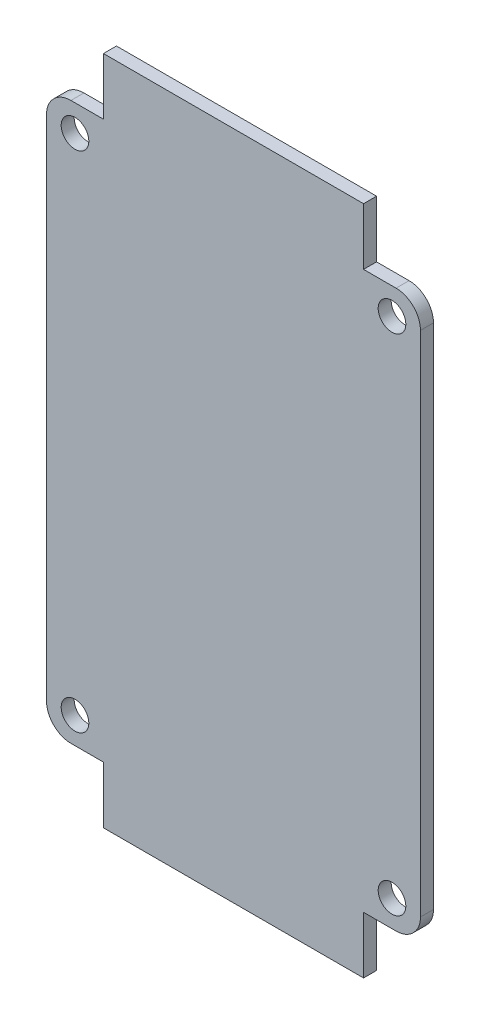
from build123d import *

# Parameters (mm, degrees)
EXTRUDE_1_DEPTH       = 1.6
HOLE_WIZARD_M31_D     = 3.4
HOLE_WIZARD_M31_DEPTH = 10
HOLE_WIZARD_M31_TIP   = 1.021463052


with BuildPart() as part:
    # Эскиз1 → Бобышка-Вытянуть1 (new body)
    with BuildSketch(Plane.XY):
        with BuildLine():
            Line((-16, 34.25), (-16, 41.25))
            Line((-16, 41.25), (16, 41.25))
            Line((16, 41.25), (16, 34.25))
            Line((16, 34.25), (20, 34.25))
            ThreePointArc((20, 34.25), (22.121320344, 33.371320344), (23, 31.25))
            Line((23, 31.25), (23, -31.25))
            ThreePointArc((23, -31.25), (22.121320344, -33.371320344), (20, -34.25))
            Line((20, -34.25), (16, -34.25))
            Line((16, -34.25), (16, -41.25))
            Line((16, -41.25), (-16, -41.25))
            Line((-16, -41.25), (-16, -34.25))
            Line((-16, -34.25), (-20, -34.25))
            ThreePointArc((-20, -34.25), (-22.121320344, -33.371320344), (-23, -31.25))
            Line((-23, -31.25), (-23, 31.25))
            ThreePointArc((-23, 31.25), (-22.121320344, 33.371320344), (-20, 34.25))
            Line((-20, 34.25), (-16, 34.25))
        make_face()
    extrude(amount=EXTRUDE_1_DEPTH)

    # Отверстие с зазором M31
    with Locations(Plane.XY.offset(1.6)):
        with Locations((-19.5, 31), (19.5, 31), (19.5, -31), (-19.5, -31)):
            Hole(HOLE_WIZARD_M31_D / 2, depth=HOLE_WIZARD_M31_DEPTH)
            with Locations((0, 0, -(HOLE_WIZARD_M31_DEPTH + HOLE_WIZARD_M31_TIP / 2))):  # 118° drill point
                Cone(0, HOLE_WIZARD_M31_D / 2, HOLE_WIZARD_M31_TIP, mode=Mode.SUBTRACT)


solid = part.part
